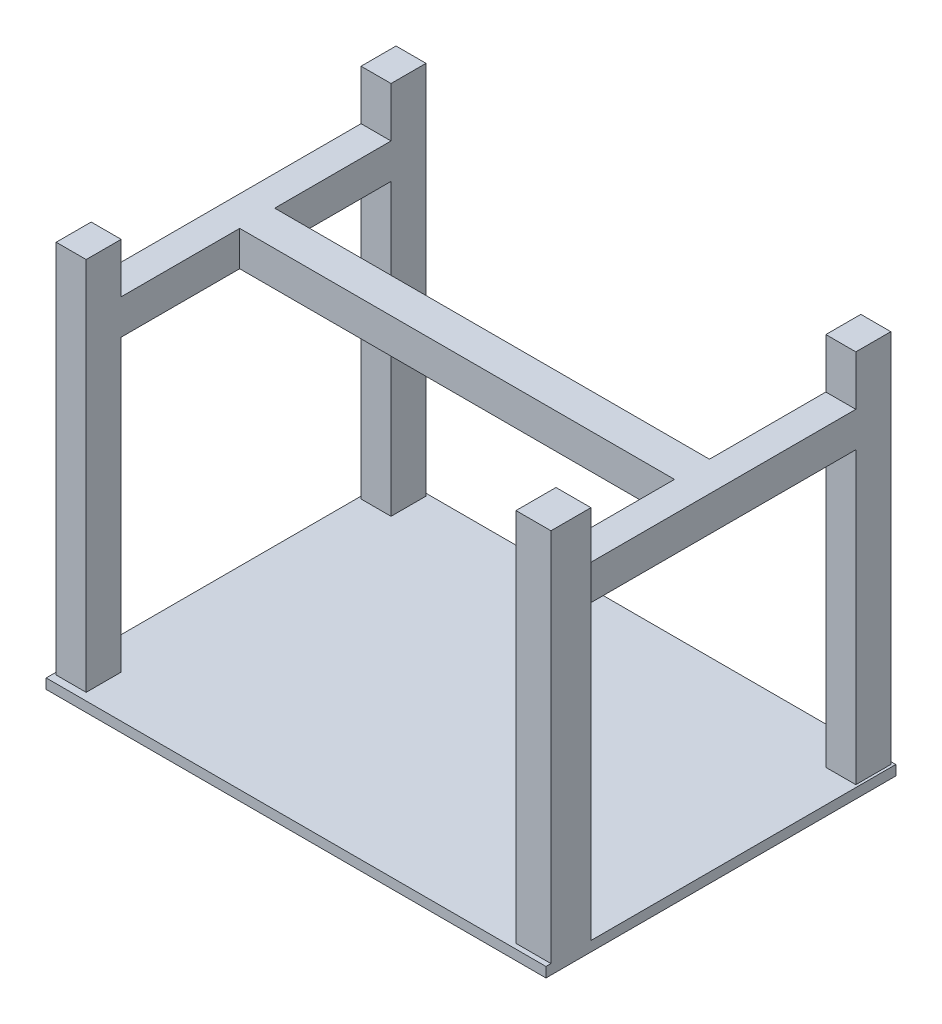
from build123d import *

# Parameters (mm, degrees)
SKETCH1_W           = 2000
SKETCH1_H           = 1400
BOSS_EXTRUDE1_DEPTH = 40
SKETCH4_W           = 120
SKETCH4_H           = 140
SKETCH4_W_2         = 140
SKETCH4_H_2         = 160
BOSS_EXTRUDE2_DEPTH = 1500
SKETCH5_W           = 120
SKETCH5_H           = 140
BOSS_EXTRUDE3_DEPTH = 1220
SKETCH6_W           = 140
SKETCH6_H           = 140
BOSS_EXTRUDE4_DEPTH = 1740


with BuildPart() as part:
    # Sketch1 → Boss-Extrude1 (new body)
    with BuildSketch(Plane(origin=(0, 0, 0), x_dir=(1, 0, 0), z_dir=(0, 1, 0))):
        Rectangle(SKETCH1_W, SKETCH1_H)
    extrude(amount=BOSS_EXTRUDE1_DEPTH)

    # Sketch4 → Boss-Extrude2 (add)
    with BuildSketch(Plane(origin=(0, 40, 0), x_dir=(1, 0, 0), z_dir=(0, 1, 0))):
        with Locations((-930, -600)):
            Rectangle(SKETCH4_W, SKETCH4_H)
        with Locations((930, 620)):
            Rectangle(SKETCH4_W, SKETCH4_H)
        with Locations((930, -600)):
            Rectangle(SKETCH4_W_2, SKETCH4_H_2)
        with Locations((-930, 620)):
            Rectangle(SKETCH4_W, SKETCH4_H)
    extrude(amount=BOSS_EXTRUDE2_DEPTH)

    # Sketch5 → Boss-Extrude3 (add)
    with BuildSketch(Plane.XY.offset(670)):
        with Locations((-930, 1270.83173518)):
            Rectangle(SKETCH5_W, SKETCH5_H)
        with Locations((930, 1270.83173518)):
            Rectangle(SKETCH5_W, SKETCH5_H)
    extrude(amount=-BOSS_EXTRUDE3_DEPTH)

    # Sketch6 → Boss-Extrude4 (add)
    with BuildSketch(Plane.ZY.offset(-870)):
        with Locations((-14.348286906, 1270.83173518)):
            Rectangle(SKETCH6_W, SKETCH6_H)
    extrude(amount=BOSS_EXTRUDE4_DEPTH)


solid = part.part
